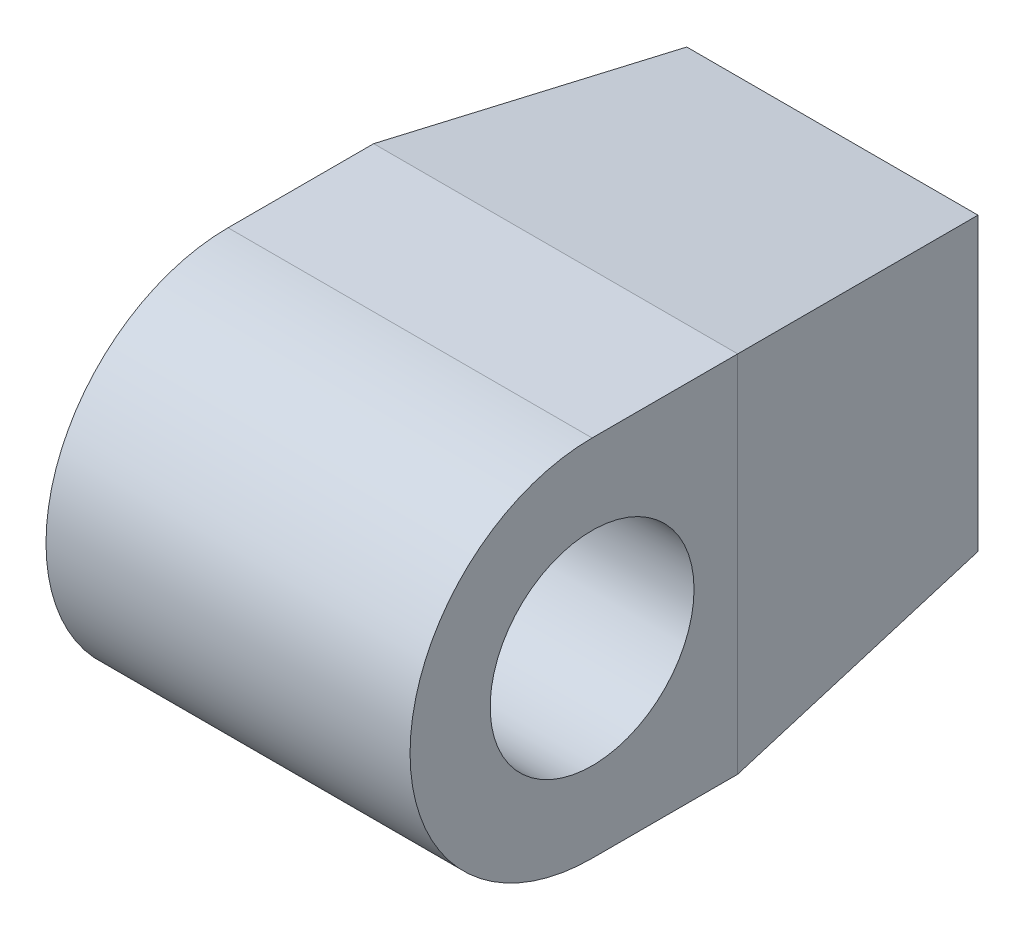
from build123d import *

# Parameters (mm, degrees)
BOSS_EXTRUDE1_DEPTH             = 12.5
BOSS_EXTRUDE1_DEPTH_BACK        = 12.5
SKETCH4_R                       = 7
CUT_EXTRUDE1_DEPTH              = 10
F_8_0MM_DOWEL_HOLE1_D           = 8
F_8_0MM_DOWEL_HOLE1_DEPTH       = 12
F_8_0MM_DOWEL_HOLE1_CSINK_D     = 8.05
F_8_0MM_DOWEL_HOLE1_CSINK_ANGLE = 90
F_8_0MM_DOWEL_HOLE1_TIP         = 2.403442476


with BuildPart() as part:
    # Sketch2 → Loft1 section 0
    with BuildSketch(Plane.XY.offset(19)):
        with BuildLine():
            Line((-12.5, -12.5), (12.5, -12.5))
            Line((12.5, -12.5), (12.5, 12.5))
            Line((12.5, 12.5), (-12.5, 12.5))
            Line((-12.5, 12.5), (-12.5, -12.5))
        make_face()
    # Sketch1 → Loft1 section 1
    with BuildSketch(Plane.XY):
        with BuildLine():
            Line((-10, -10), (10, -10))
            Line((10, -10), (10, 10))
            Line((10, 10), (-10, 10))
            Line((-10, 10), (-10, -10))
        make_face()
    loft()

    # Sketch3 → Boss-Extrude1 (add, two sides: drawn at the far end of the back side and taken through both)
    with BuildSketch(Plane(origin=(0, 0, 0), x_dir=(0, 0, -1), z_dir=(1, 0, 0)).offset(-BOSS_EXTRUDE1_DEPTH_BACK)):
        with BuildLine():
            Line((-19, 12.5), (-29, 12.5))
            ThreePointArc((-29, 12.5), (-41.5, 0), (-29, -12.5))
            Line((-29, -12.5), (-19, -12.5))
            Line((-19, -12.5), (-19, 12.5))
        make_face()
    extrude(amount=BOSS_EXTRUDE1_DEPTH + BOSS_EXTRUDE1_DEPTH_BACK)

    # Sketch4 → Cut-Extrude1 (cut)
    with BuildSketch(Plane(origin=(12.5001, 0, 0), x_dir=(0, 0, -1), z_dir=(1, 0, 0))):
        with Locations((-29, 0)):
            Circle(SKETCH4_R)
    extrude(amount=-CUT_EXTRUDE1_DEPTH, mode=Mode.SUBTRACT)

    # Ø8.0mm Dowel Hole1
    with Locations(Plane(origin=(0, 0, 0), x_dir=(-1, 0, 0), z_dir=(0, 0, -1))):
        with Locations((0, 0)):
            CounterSinkHole(F_8_0MM_DOWEL_HOLE1_D / 2, F_8_0MM_DOWEL_HOLE1_CSINK_D / 2, depth=F_8_0MM_DOWEL_HOLE1_DEPTH, counter_sink_angle=F_8_0MM_DOWEL_HOLE1_CSINK_ANGLE)
            with Locations((0, 0, -(F_8_0MM_DOWEL_HOLE1_DEPTH + F_8_0MM_DOWEL_HOLE1_TIP / 2))):  # 118° drill point
                Cone(0, F_8_0MM_DOWEL_HOLE1_D / 2, F_8_0MM_DOWEL_HOLE1_TIP, mode=Mode.SUBTRACT)


solid = part.part
